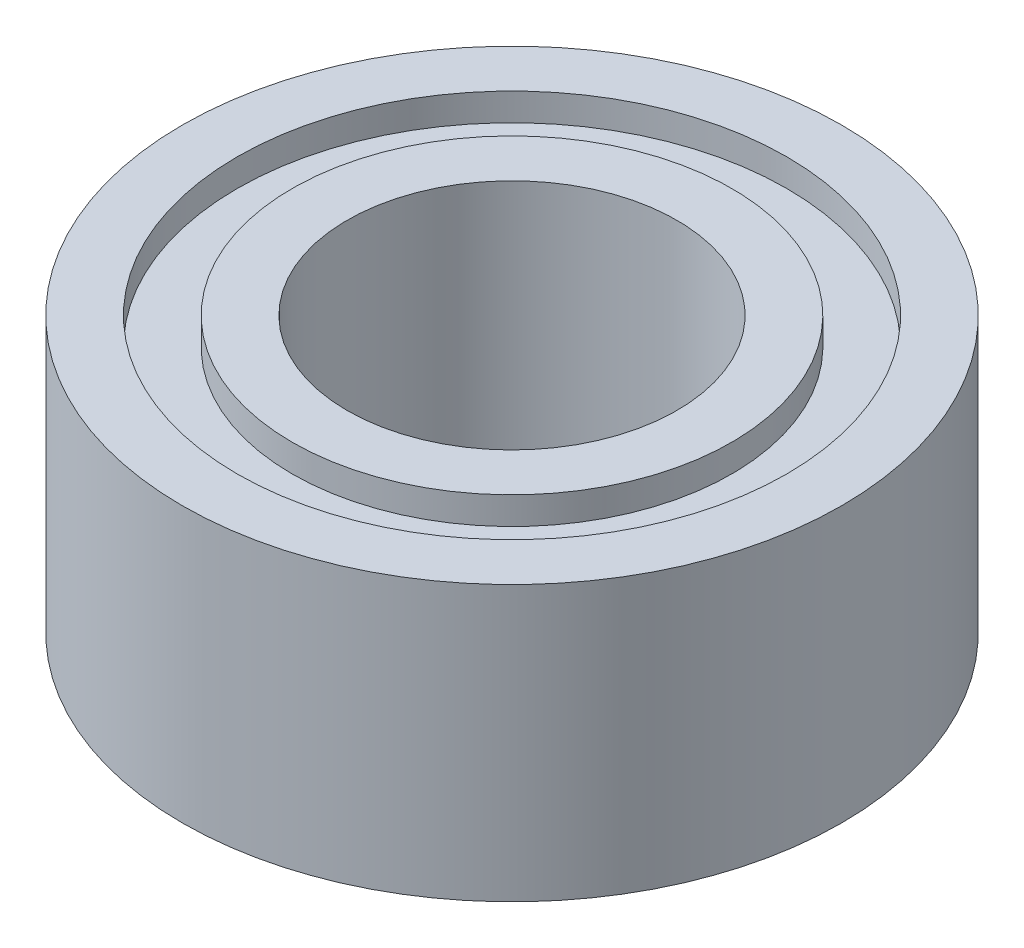
from build123d import *

# Parameters (mm, degrees)
EXTRUDE_1_DEPTH      = 1.25
EXTRUDE_1_DEPTH_BACK = 1.25
SKETCH_1_R           = 2
SKETCH_1_R_2         = 1.5
EXTRUDE_2_DEPTH      = 1
EXTRUDE_2_DEPTH_BACK = 1
SKETCH_2_R           = 2.5
SKETCH_2_R_2         = 2
EXTRUDE_3_DEPTH      = 1.25
EXTRUDE_3_DEPTH_BACK = 1.25
SKETCH_3_R           = 3
SKETCH_3_R_2         = 2.5


with BuildPart() as part:
    # 草图1 → 凸台-拉伸1 (new, two sides: drawn at the far end of the back side and taken through both)
    with BuildSketch(Plane(origin=(0, 0, 0), x_dir=(1, 0, 0), z_dir=(0, 1, 0)).offset(-EXTRUDE_1_DEPTH_BACK)):
        Circle(SKETCH_1_R)
        Circle(SKETCH_1_R_2, mode=Mode.SUBTRACT)
    extrude(amount=EXTRUDE_1_DEPTH + EXTRUDE_1_DEPTH_BACK)

    # 草图2 → 凸台-拉伸2 (add, two sides: drawn at the far end of the back side and taken through both)
    with BuildSketch(Plane(origin=(0, 0, 0), x_dir=(1, 0, 0), z_dir=(0, 1, 0)).offset(-EXTRUDE_2_DEPTH_BACK)):
        Circle(SKETCH_2_R)
        Circle(SKETCH_2_R_2, mode=Mode.SUBTRACT)
    extrude(amount=EXTRUDE_2_DEPTH + EXTRUDE_2_DEPTH_BACK)

    # 草图3 → 凸台-拉伸3 (add, two sides: drawn at the far end of the back side and taken through both)
    with BuildSketch(Plane(origin=(0, 0, 0), x_dir=(1, 0, 0), z_dir=(0, 1, 0)).offset(-EXTRUDE_3_DEPTH_BACK)):
        Circle(SKETCH_3_R)
        Circle(SKETCH_3_R_2, mode=Mode.SUBTRACT)
    extrude(amount=EXTRUDE_3_DEPTH + EXTRUDE_3_DEPTH_BACK)


solid = part.part
